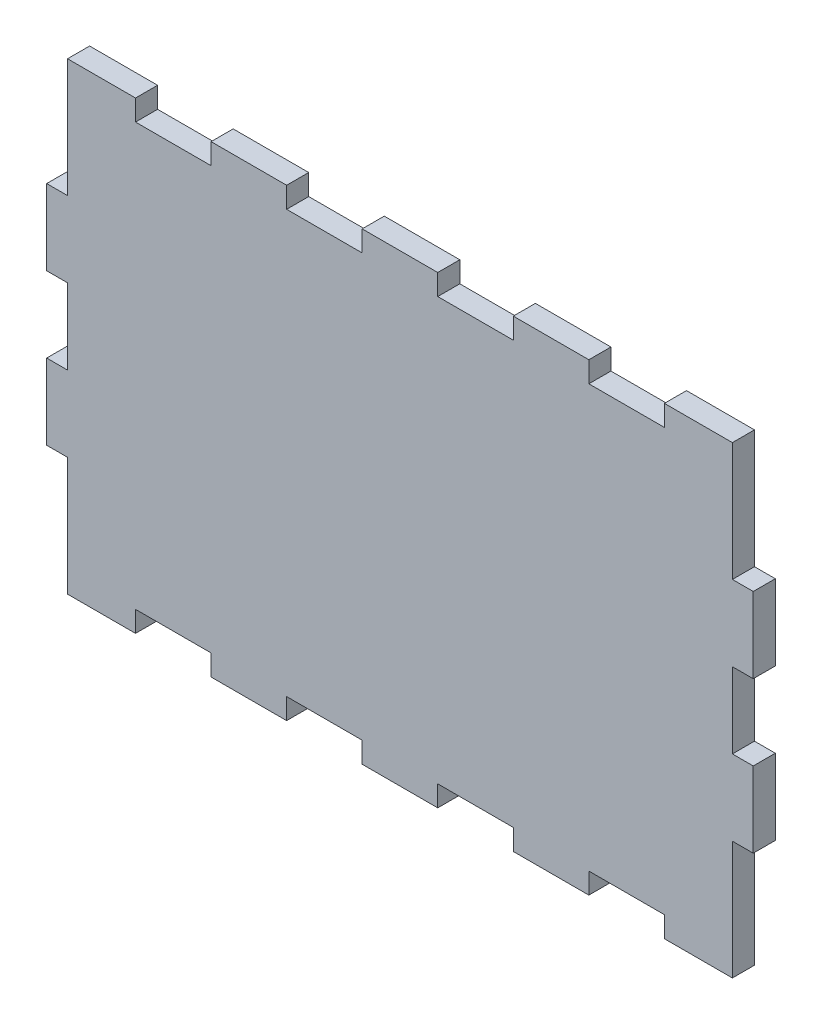
from build123d import *

# Parameters (mm, degrees)
BOSS_EXTRUDE1_DEPTH = 6.35


with BuildPart() as part:
    # Sketch3 → Boss-Extrude1 (new body)
    with BuildSketch(Plane.XY):
        Polygon((25.54605, 133.35), (5.9944, 133.35), (5.9944, 99.26955), (0, 99.26955), (0, 77.53985), (5.9944, 77.53985), (5.9944, 55.81015), (0, 55.81015), (0, 34.08045), (5.9944, 34.08045), (5.9944, 12.35075), (5.9944, 0), (25.54605, 0), (25.54605, 5.9944), (47.27575, 5.9944), (47.27575, 0), (69.00545, 0), (69.00545, 5.9944), (90.73515, 5.9944), (90.73515, 0), (112.46485, 0), (112.46485, 5.9944), (134.19455, 5.9944), (134.19455, 0), (155.92425, 0), (155.92425, 5.9944), (177.65395, 5.9944), (177.65395, 0), (197.2056, 0), (197.2056, 34.08045), (203.2, 34.08045), (203.2, 55.81015), (197.2056, 55.81015), (197.2056, 77.53985), (203.2, 77.53985), (203.2, 99.26955), (197.2056, 99.26955), (197.2056, 120.99925), (197.2056, 133.35), (177.65395, 133.35), (177.65395, 127.3556), (155.92425, 127.3556), (155.92425, 133.35), (134.19455, 133.35), (134.19455, 127.3556), (112.46485, 127.3556), (112.46485, 133.35), (90.73515, 133.35), (90.73515, 127.3556), (69.00545, 127.3556), (69.00545, 133.35), (47.27575, 133.35), (47.27575, 127.3556), (25.54605, 127.3556), align=None)
    extrude(amount=BOSS_EXTRUDE1_DEPTH)


solid = part.part
